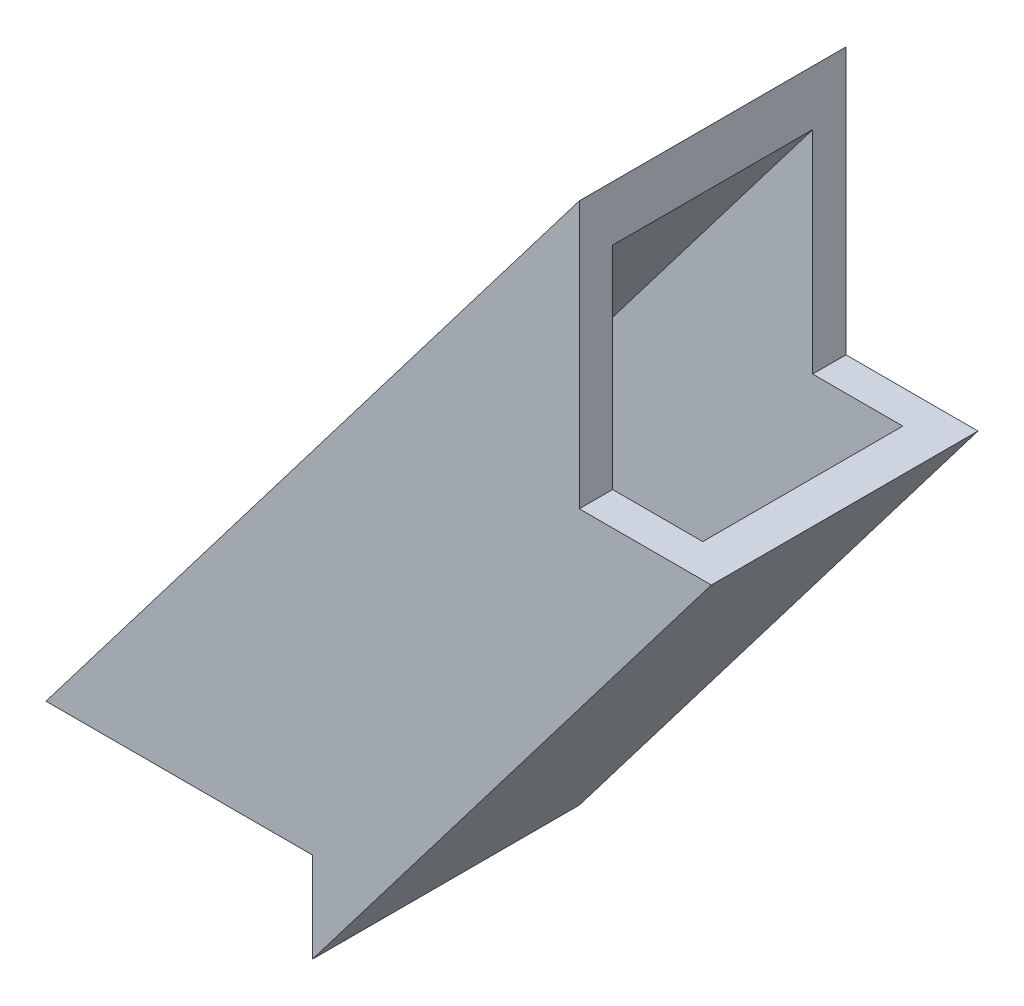
from build123d import *

# Parameters (mm, degrees)
BOSS_EXTRUDE1_DEPTH      = 8.573703
BOSS_EXTRUDE1_DEPTH_BACK = 75.248703
SKETCH1_W                = 25.4
SKETCH1_H                = 25.4
SKETCH1_W_2              = 19.05
SKETCH1_H_2              = 19.05
SKETCH2_W                = 25.4
SKETCH2_H                = 25.4
SKETCH2_H_2              = 50.8
CUT_EXTRUDE1_DEPTH       = 419.066662472


with BuildPart() as part:
    # Sketch1 → Boss-Extrude1 (new, two sides: drawn at the far end of the back side and taken through both)
    with BuildSketch(Plane(origin=(115.396321255, 151.457671647, 0), x_dir=(-0.7954317200324988, 0.606043215262856, 0), z_dir=(-0.606043215262856, -0.7954317200324988, 0)).offset(-BOSS_EXTRUDE1_DEPTH_BACK)):
        with Locations((-209.448142065, -215.9)):
            Rectangle(SKETCH1_W, SKETCH1_H)
        with Locations((-209.448142065, -215.9)):
            Rectangle(SKETCH1_W_2, SKETCH1_H_2, mode=Mode.SUBTRACT)
    extrude(amount=BOSS_EXTRUDE1_DEPTH + BOSS_EXTRUDE1_DEPTH_BACK)

    # Sketch2 → Cut-Extrude1 (cut, through all)
    with BuildSketch(Plane.XY):
        with Locations((330.2, 79.375)):
            Rectangle(SKETCH2_W, SKETCH2_H)
        with Locations((279.4, 0)):
            Rectangle(SKETCH2_W, SKETCH2_H_2)
    extrude(amount=CUT_EXTRUDE1_DEPTH, mode=Mode.SUBTRACT)


solid = part.part
